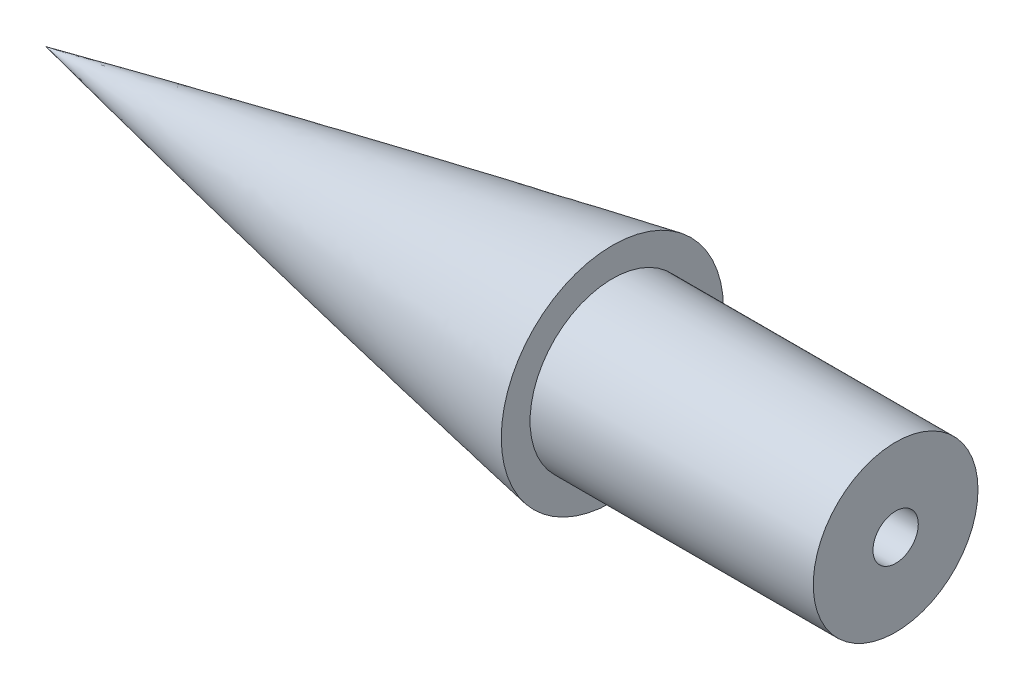
from build123d import *

# Parameters (mm, degrees)
SKETCH3_R          = 4
CUT_EXTRUDE1_DEPTH = 40


with BuildPart() as part:
    # Sketch1 → Revolve1 (revolve)
    with BuildSketch(Plane.XY, mode=Mode.PRIVATE) as revolve1_sk:
        with BuildLine():
            Line((-600, 3571.838497189), (-650, 3571.838497189))
            ThreePointArc((-650, 3571.838497189), (-687.726318416, 3564.766859271), (-725.37576469, 3557.296761587))
            Line((-725.37576469, 3557.296761587), (-600, 3557.296761587))
            Line((-600, 3557.296761587), (-600, 3571.838497189))
        make_face()
        with BuildLine():
            Line((-650, 3571.838497189), (-650, 3576.920498138))
            ThreePointArc((-650, 3576.920498138), (-700.068762879, 3567.459036519), (-750, 3557.296761587))
            Line((-750, 3557.296761587), (-725.37576469, 3557.296761587))
            ThreePointArc((-725.37576469, 3557.296761587), (-687.726318416, 3564.766859271), (-650, 3571.838497189))
        make_face()
    revolve(revolve1_sk.sketch.rotate(Axis((0, 3557.296761587, 0), (-1, 0, 0)), 90), axis=Axis((0, 3557.296761587, 0), (-1, 0, 0)))

    # Sketch3 → Cut-Extrude1 (cut)
    with BuildSketch(Plane(origin=(-600, 0, 0), x_dir=(0, 0, -1), z_dir=(1, 0, 0))):
        with Locations((0, 3557.296761587)):
            Circle(SKETCH3_R)
    extrude(amount=-CUT_EXTRUDE1_DEPTH, mode=Mode.SUBTRACT)


solid = part.part
